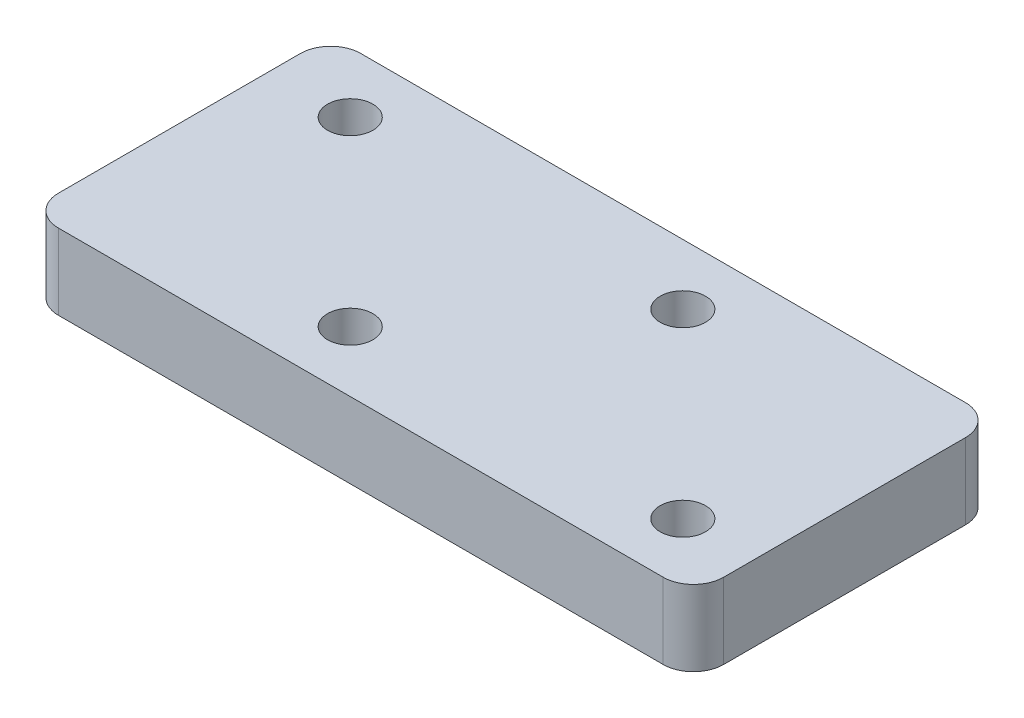
from build123d import *

# Parameters (mm, degrees)
SKETCH_1_W      = 44
SKETCH_1_H      = 20
SKETCH_1_R      = 1.5
EXTRUDE_1_DEPTH = 5
FILLET_1_R      = 2


with BuildPart() as part:
    # 草图1 → 凸台-拉伸1 (new body)
    with BuildSketch(Plane(origin=(0, 0, 0), x_dir=(1, 0, 0), z_dir=(0, 1, 0))):
        with Locations((22, 10)):
            Rectangle(SKETCH_1_W, SKETCH_1_H)
        with Locations(Location((5.3, 16, 0), (0, 0, 270))):
            Circle(SKETCH_1_R, mode=Mode.SUBTRACT)
        with Locations(Location((17.3, 4, 0), (0, 0, 270))):
            Circle(SKETCH_1_R, mode=Mode.SUBTRACT)
        with Locations(Location((27.3, 16, 0), (0, 0, 270))):
            Circle(SKETCH_1_R, mode=Mode.SUBTRACT)
        with Locations(Location((39.3, 4, 0), (0, 0, 270))):
            Circle(SKETCH_1_R, mode=Mode.SUBTRACT)
    extrude(amount=EXTRUDE_1_DEPTH)

    # 圆角1
    fillet_1_edges = [part.edges().sort_by_distance(p)[0] for p in [
        (0, 2.5, -20),
        (44, 2.5, -20),
        (44, 2.5, 0),
        (0, 2.5, 0),
    ]]
    fillet(fillet_1_edges, radius=FILLET_1_R)


solid = part.part
